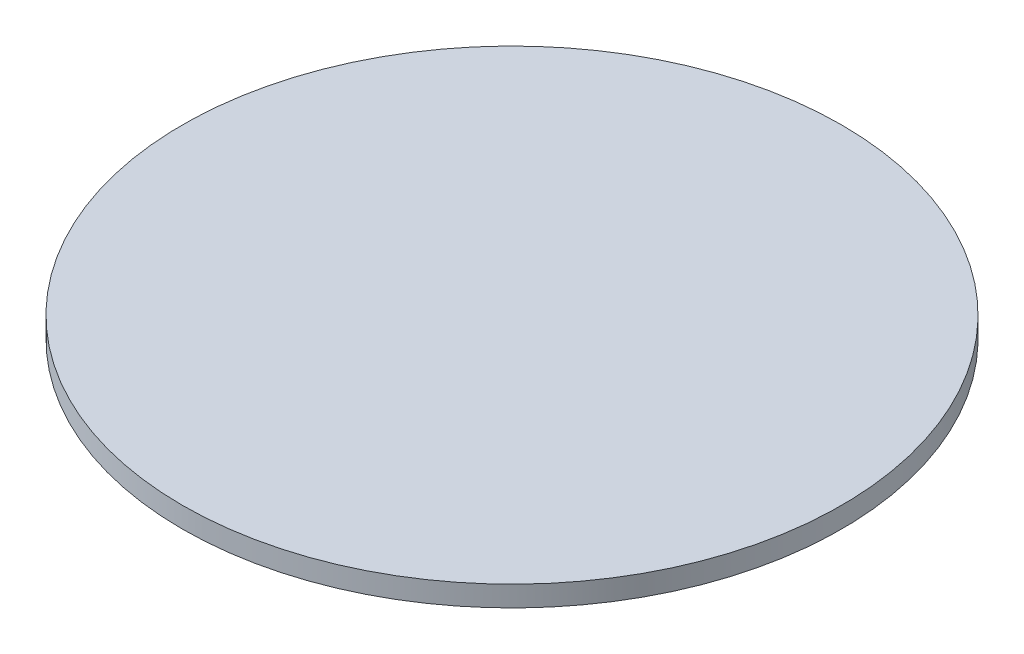
from build123d import *

# Parameters (mm, degrees)
SKETCH1_R           = 101.6
BOSS_EXTRUDE1_DEPTH = 6.35


with BuildPart() as part:
    # Sketch1 → Boss-Extrude1 (new body)
    with BuildSketch(Plane(origin=(0, 0, 0), x_dir=(1, 0, 0), z_dir=(0, 1, 0))):
        with Locations(Location((0, 0, 0), (0, 0, 270))):
            Circle(SKETCH1_R)
    extrude(amount=BOSS_EXTRUDE1_DEPTH)


solid = part.part
